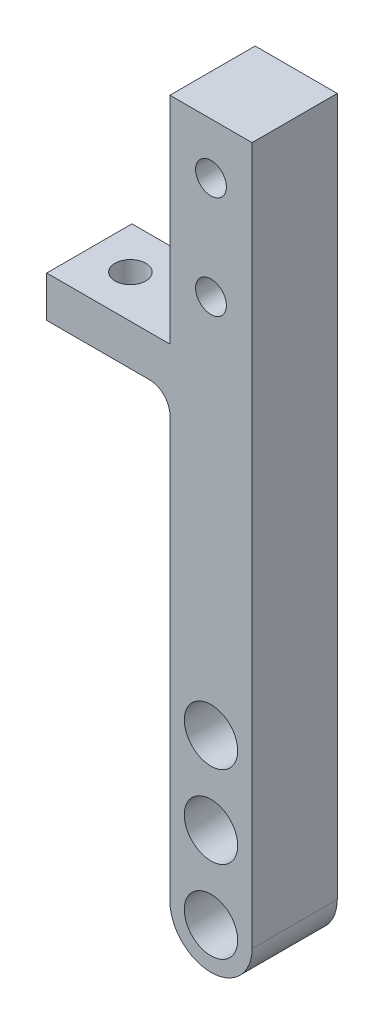
from build123d import *

# Parameters (mm, degrees)
CROQUIS1_R              = 2.6
CROQUIS1_R_2            = 1.5
CROQUIS1_W              = 12
CROQUIS1_H              = 4
SALIENTE_EXTRUIR1_DEPTH = 4.15
CROQUIS2_R              = 1.5
CORTAR_EXTRUIR1_DEPTH   = 10
REDONDEO2_R             = 2


with BuildPart() as part:
    # Croquis1 → Saliente-Extruir1 (new, symmetric)
    # profile 1 of 2: a face of its own
    with BuildSketch(Plane.XY):
        with BuildLine():
            Line((-14.490607503, -1040.48), (-14.490607503, -1037.604369418))
            Line((-14.490607503, -1037.604369418), (-14.490607503, -972.48))
            Line((-14.490607503, -972.48), (-22.490607503, -972.48))
            Line((-22.490607503, -972.48), (-22.490607503, -993.48))
            Line((-22.490607503, -993.48), (-22.490607503, -997.48))
            Line((-22.490607503, -997.48), (-22.490607503, -1024.48))
            Line((-22.490607503, -1024.48), (-22.490607503, -1040.48))
            ThreePointArc((-22.490607503, -1040.48), (-18.490607503, -1044.48), (-14.490607503, -1040.48))
        make_face()
        with Locations(Location((-18.490607503, -1040.48, 0), (0, 0, 180))):
            Circle(CROQUIS1_R, mode=Mode.SUBTRACT)
        with Locations(Location((-18.490607503, -1032.48, 0), (0, 0, 180))):
            Circle(CROQUIS1_R, mode=Mode.SUBTRACT)
        with Locations(Location((-18.490607503, -1024.48, 0), (0, 0, 180))):
            Circle(CROQUIS1_R, mode=Mode.SUBTRACT)
        with Locations(Location((-18.490607503, -987.48, 0), (0, 0, 180))):
            Circle(CROQUIS1_R_2, mode=Mode.SUBTRACT)
        with Locations(Location((-18.490607503, -977.48, 0), (0, 0, 180))):
            Circle(CROQUIS1_R_2, mode=Mode.SUBTRACT)
    # profile 2 of 2: a face of its own
    with BuildSketch(Plane.XY):
        with Locations((-28.490607503, -995.48)):
            Rectangle(CROQUIS1_W, CROQUIS1_H)
    extrude(amount=SALIENTE_EXTRUIR1_DEPTH, both=True)

    # Croquis2 → Cortar-Extruir1 (cut)
    with BuildSketch(Plane(origin=(0, -993.48, 0), x_dir=(1, 0, 0), z_dir=(0, 1, 0))):
        with Locations(Location((-30.490607503, 0, 0), (0, 0, 270))):
            Circle(CROQUIS2_R)
    extrude(amount=-CORTAR_EXTRUIR1_DEPTH, mode=Mode.SUBTRACT)

    # Redondeo2
    redondeo2_edges = [part.edges().sort_by_distance(p)[0] for p in [
        (-22.490607503, -997.48, 0),
    ]]
    fillet(redondeo2_edges, radius=REDONDEO2_R)


solid = part.part
